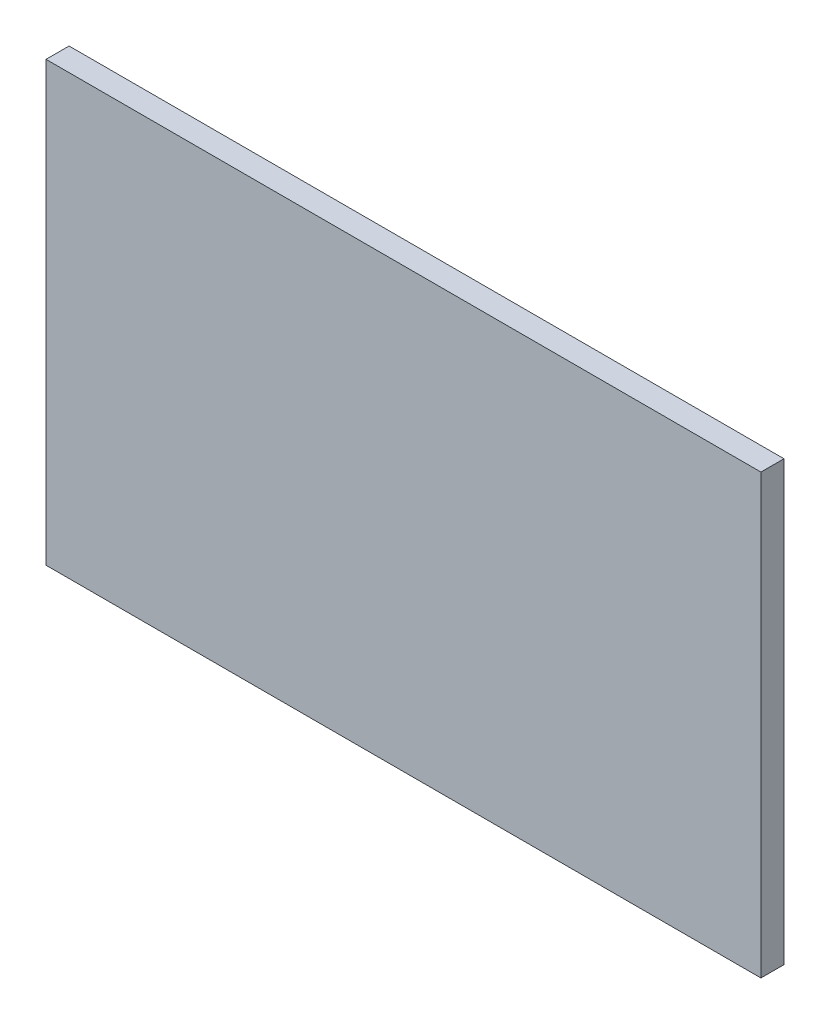
from build123d import *

# Parameters (mm, degrees)
SKETCH1_W           = 31
SKETCH1_H           = 19
BOSS_EXTRUDE1_DEPTH = 1


with BuildPart() as part:
    # Sketch1 → Boss-Extrude1 (new body)
    with BuildSketch(Plane.XY):
        Rectangle(SKETCH1_W, SKETCH1_H)
    extrude(amount=BOSS_EXTRUDE1_DEPTH)


solid = part.part
